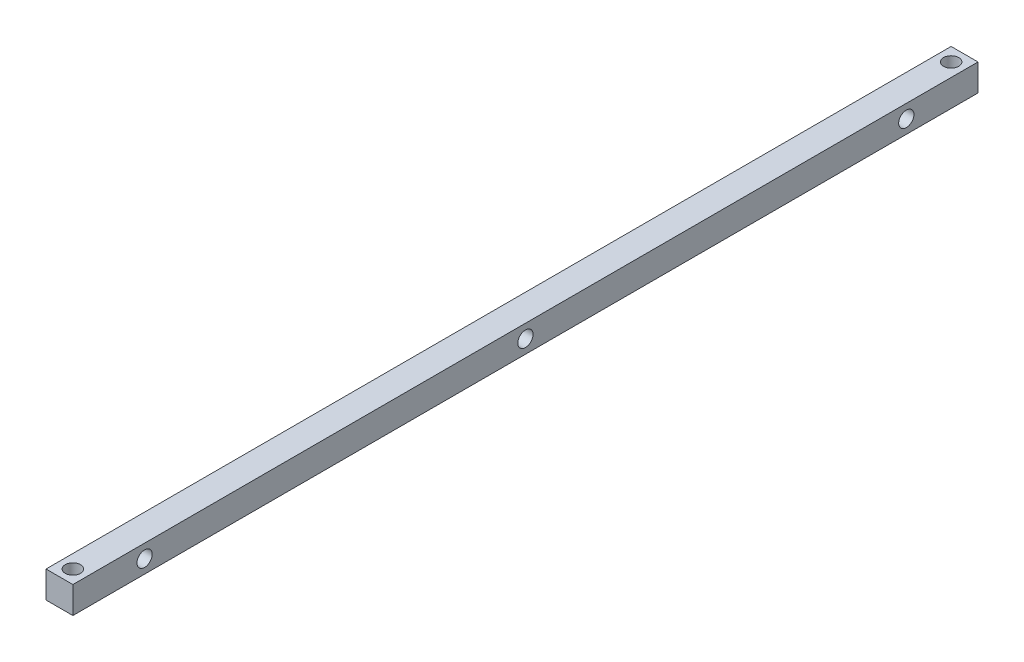
from build123d import *

# Parameters (mm, degrees)
SKETCH1_W           = 15
SKETCH1_H           = 15
BOSS_EXTRUDE1_DEPTH = 252.5
HOLE2_D             = 8.5
HOLE2_CBORE_D       = 14
HOLE2_CBORE_DEPTH   = 8
HOLE3_D             = 8.5
HOLE3_CBORE_D       = 14
HOLE3_CBORE_DEPTH   = 8
LPATTERN1_COUNT     = 3
LPATTERN1_PITCH     = 212.5


with BuildPart() as part:
    # Sketch1 → Boss-Extrude1 (new, symmetric)
    with BuildSketch(Plane.XY):
        Rectangle(SKETCH1_W, SKETCH1_H)
    extrude(amount=BOSS_EXTRUDE1_DEPTH, both=True)

    # Hole2 (through all)
    with Locations(Plane(origin=(0, -7.5, 0), x_dir=(-1, 0, 0), z_dir=(0, -1, 0))):
        with Locations((0, 245)):
            hole2 = CounterBoreHole(HOLE2_D / 2, HOLE2_CBORE_D / 2, HOLE2_CBORE_DEPTH)

    # Mirror1: Hole2 across plane
    add(hole2.mirror(Plane.XY), mode=Mode.SUBTRACT)

    # Hole3 (through all)
    with Locations(Plane.ZY.offset(7.5)):
        with Locations((-212.5, 0)):
            hole3 = CounterBoreHole(HOLE3_D / 2, HOLE3_CBORE_D / 2, HOLE3_CBORE_DEPTH)

    # LPattern1: Hole3 ×3
    with Locations(*[(0, 0, i * LPATTERN1_PITCH) for i in range(1, LPATTERN1_COUNT)]):
        add(hole3, mode=Mode.SUBTRACT)


solid = part.part
